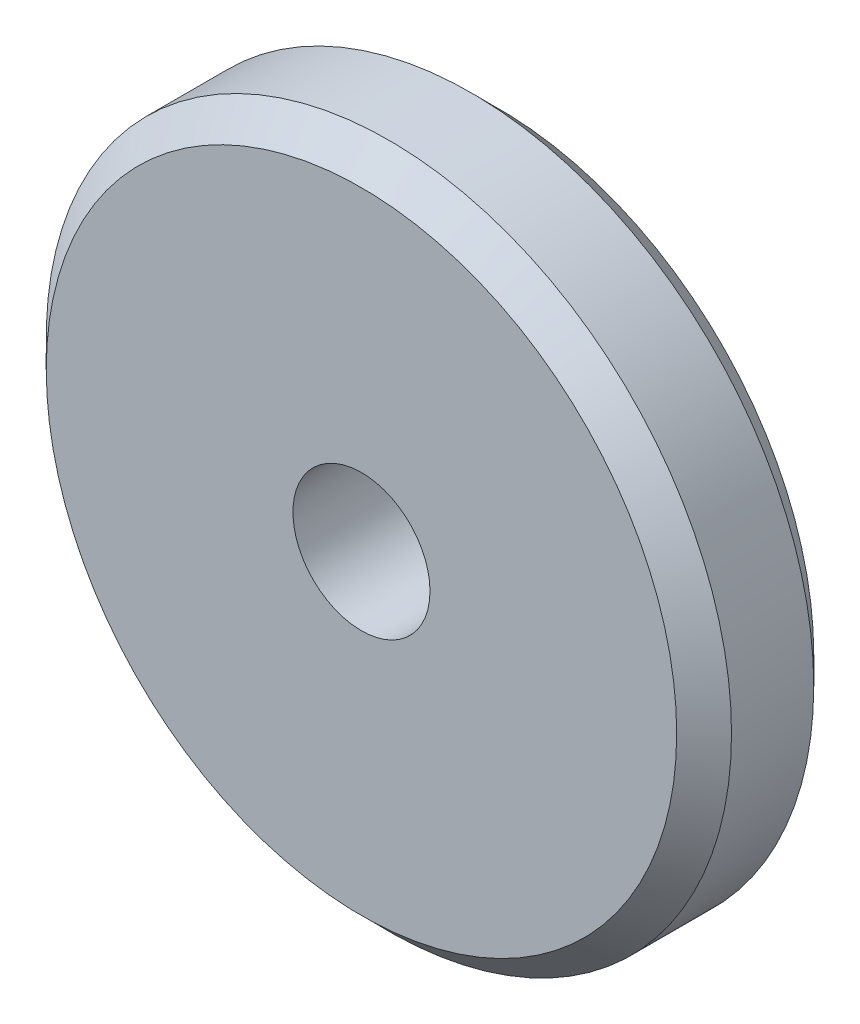
from build123d import *

# Parameters (mm, degrees)
SKETCH1_R           = 25
SKETCH1_R_2         = 5
BOSS_EXTRUDE1_DEPTH = 10
CHAMFER1_SIZE       = 2


with BuildPart() as part:
    # Sketch1 → Boss-Extrude1 (new body)
    with BuildSketch(Plane.XY):
        Circle(SKETCH1_R)
        Circle(SKETCH1_R_2, mode=Mode.SUBTRACT)
    extrude(amount=BOSS_EXTRUDE1_DEPTH)

    # Chamfer1
    chamfer1_edges = [part.edges().sort_by_distance(p)[0] for p in [
        (-25, 0, 0),
        (-25, 0, 10),
    ]]
    chamfer(chamfer1_edges, length=CHAMFER1_SIZE)


solid = part.part
